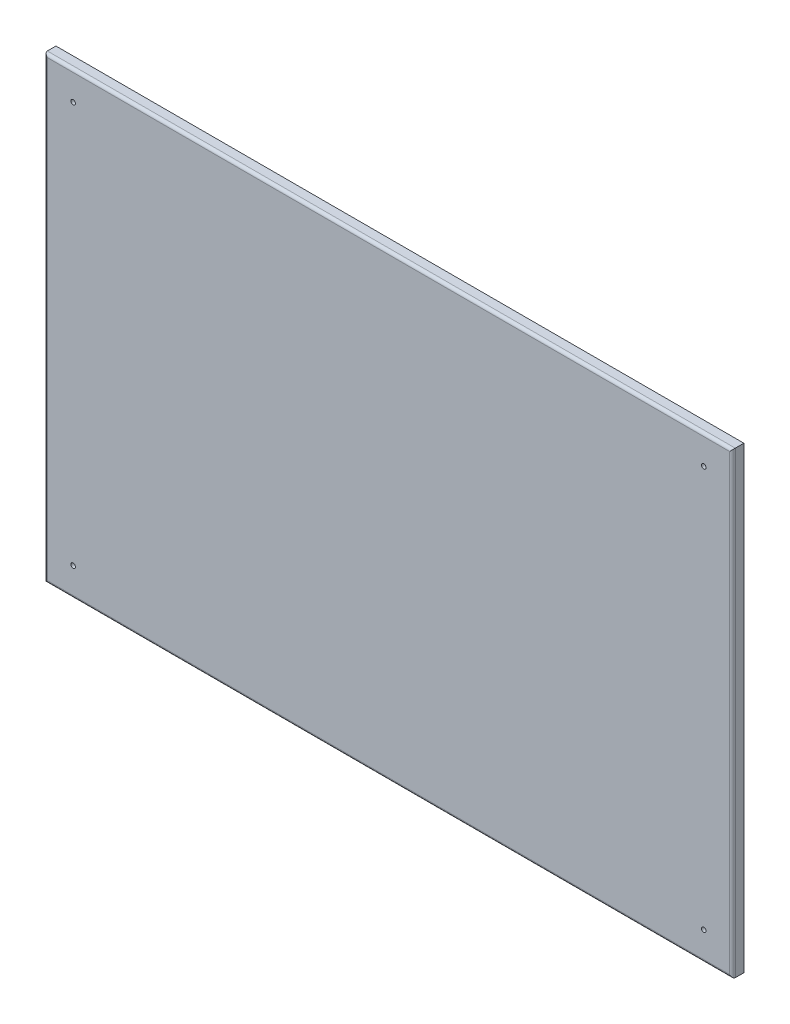
from build123d import *

# Parameters (mm, degrees)
SKETCH1_W           = 1200
SKETCH1_H           = 800
BOSS_EXTRUDE1_DEPTH = 20
FILLET1_R           = 5
SKETCH2_R           = 4
CUT_EXTRUDE1_DEPTH  = 20
SKETCH3_R           = 4
CUT_EXTRUDE2_DEPTH  = 20
SKETCH4_R           = 4
CUT_EXTRUDE3_DEPTH  = 20
SKETCH5_R           = 4
CUT_EXTRUDE4_DEPTH  = 20


with BuildPart() as part:
    # Sketch1 → Boss-Extrude1 (new body)
    with BuildSketch(Plane.XY):
        Rectangle(SKETCH1_W, SKETCH1_H)
    extrude(amount=BOSS_EXTRUDE1_DEPTH)

    # Fillet1
    fillet1_edges = [part.edges().sort_by_distance(p)[0] for p in [
        (0, -400, 20),
        (0, 400, 20),
        (-600, 0, 20),
        (600, 0, 20),
    ]]
    fillet(fillet1_edges, radius=FILLET1_R)

    # Sketch2 → Cut-Extrude1 (cut)
    with BuildSketch(Plane.XY):
        with Locations((550, 350)):
            Circle(SKETCH2_R)
    extrude(amount=CUT_EXTRUDE1_DEPTH, mode=Mode.SUBTRACT)

    # Sketch3 → Cut-Extrude2 (cut)
    with BuildSketch(Plane.XY):
        with Locations((550, -350)):
            Circle(SKETCH3_R)
    extrude(amount=CUT_EXTRUDE2_DEPTH, mode=Mode.SUBTRACT)

    # Sketch4 → Cut-Extrude3 (cut)
    with BuildSketch(Plane.XY):
        with Locations((-550, 350)):
            Circle(SKETCH4_R)
    extrude(amount=CUT_EXTRUDE3_DEPTH, mode=Mode.SUBTRACT)

    # Sketch5 → Cut-Extrude4 (cut)
    with BuildSketch(Plane.XY):
        with Locations((-550, -350)):
            Circle(SKETCH5_R)
    extrude(amount=CUT_EXTRUDE4_DEPTH, mode=Mode.SUBTRACT)


solid = part.part
